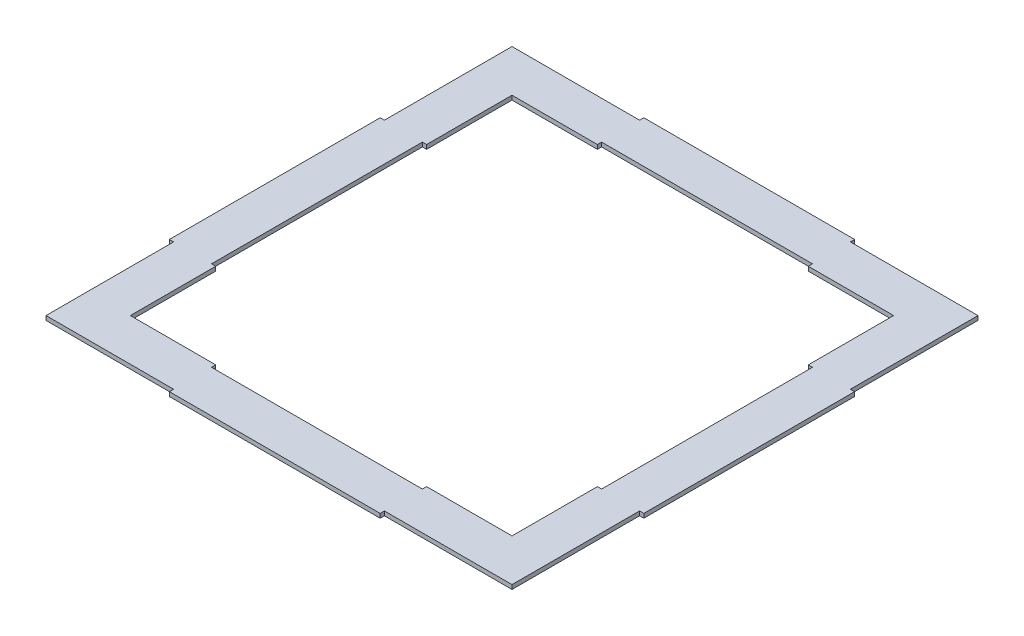
from build123d import *

# Parameters (mm, degrees)
BOSS_EXTRUDE1_DEPTH = 4


with BuildPart() as part:
    # Sketch1 → Boss-Extrude1 (new body)
    with BuildSketch(Plane(origin=(0, 0, 0), x_dir=(1, 0, 0), z_dir=(0, 1, 0))):
        Polygon((-219.316556264, 100.420860934), (-223.316556264, 100.420860934), (-223.316556264, -99.579139066), (-219.316556264, -99.579139066), (-219.316556264, -220.579139066), (-98.316556264, -220.579139066), (-98.316556264, -224.579139066), (101.683443736, -224.579139066), (101.683443736, -220.579139066), (222.683443736, -220.579139066), (222.683443736, -99.579139066), (226.683443736, -99.579139066), (226.683443736, 100.420860934), (222.683443736, 100.420860934), (222.683443736, 221.420860934), (101.683443736, 221.420860934), (101.683443736, 225.420860934), (-98.316556264, 225.420860934), (-98.316556264, 221.420860934), (-219.316556264, 221.420860934), align=None)
        Polygon((-179.316556264, -180.579139066), (-98.316556264, -180.579139066), (-98.316556264, -184.579139066), (101.683443736, -184.579139066), (101.683443736, -180.579139066), (182.683443736, -180.579139066), (182.683443736, -99.579139066), (186.683443736, -99.579139066), (186.683443736, 100.420860934), (182.683443736, 100.420860934), (182.683443736, 181.420860934), (101.683443736, 181.420860934), (101.683443736, 185.420860934), (-98.316556264, 185.420860934), (-98.316556264, 181.420860934), (-179.316556264, 181.420860934), (-179.316556264, 100.420860934), (-183.316556264, 100.420860934), (-183.316556264, -99.579139066), (-179.316556264, -99.579139066), align=None, mode=Mode.SUBTRACT)
    extrude(amount=BOSS_EXTRUDE1_DEPTH)


solid = part.part
